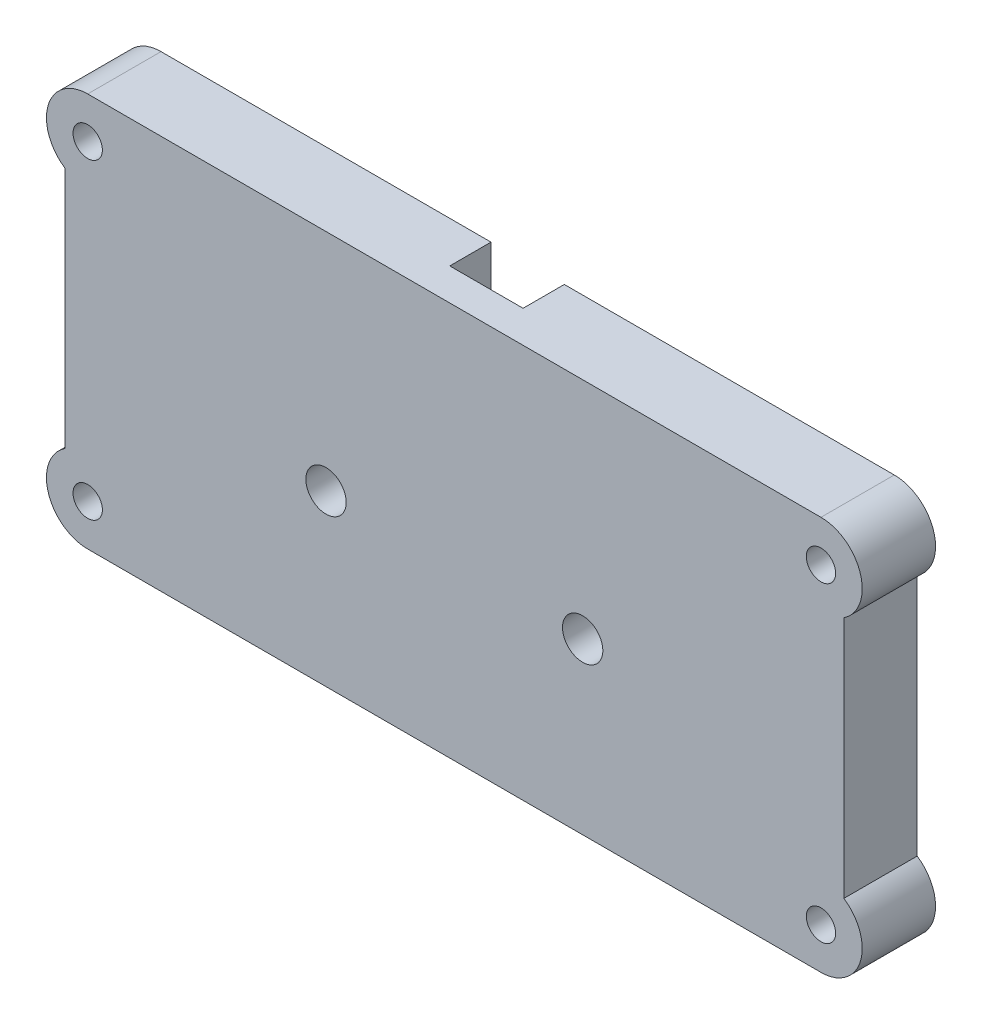
from build123d import *

# Parameters (mm, degrees)
SKETCH1_R           = 1.6
BOSS_EXTRUDE1_DEPTH = 8
CUT_EXTRUDE4_DEPTH  = 1.7
CUT_EXTRUDE5_DEPTH  = 7.4
SKETCH1_9_W         = 8
SKETCH1_9_H         = 13.9
CUT_EXTRUDE6_DEPTH  = 4.5
SKETCH2_R           = 2.2
CUT_EXTRUDE11_DEPTH = 6


with BuildPart() as part:
    # Sketch1 → Boss-Extrude1 (new body)
    with BuildSketch(Plane.XY):
        with BuildLine():
            Line((-42.5, 13.258342613), (-42.5, -13.258342613))
            ThreePointArc((-42.5, -13.258342613), (-44.30624304, -18.30624304), (-40, -21.5))
            Line((-40, -21.5), (40, -21.5))
            ThreePointArc((40, -21.5), (44.30624304, -18.30624304), (42.5, -13.258342613))
            Line((42.5, -13.258342613), (42.5, 13.258342613))
            ThreePointArc((42.5, 13.258342613), (44.30624304, 18.30624304), (40, 21.5))
            Line((40, 21.5), (-40, 21.5))
            ThreePointArc((-40, 21.5), (-44.30624304, 18.30624304), (-42.5, 13.258342613))
        make_face()
        with Locations((-40, -17)):
            Circle(SKETCH1_R, mode=Mode.SUBTRACT)
        with Locations((40, -17)):
            Circle(SKETCH1_R, mode=Mode.SUBTRACT)
        with Locations((-40, 17)):
            Circle(SKETCH1_R, mode=Mode.SUBTRACT)
        with Locations((40, 17)):
            Circle(SKETCH1_R, mode=Mode.SUBTRACT)
    extrude(amount=BOSS_EXTRUDE1_DEPTH)

    # Sketch1<7> → Cut-Extrude4 (cut)
    with BuildSketch(Plane.XY):
        with BuildLine():
            Line((-5.489949494, 9.874011537), (-9.828784258, 14.212846302))
            ThreePointArc((-9.828784258, 14.212846302), (-14.212846302, 14.212846302), (-14.212846302, 9.828784258))
            Line((-14.212846302, 9.828784258), (-9.874011537, 5.489949494))
            ThreePointArc((-9.874011537, 5.489949494), (-7.6, 0), (-9.874011537, -5.489949494))
            Line((-9.874011537, -5.489949494), (-14.212846302, -9.828784258))
            ThreePointArc((-14.212846302, -9.828784258), (-14.212846302, -14.212846302), (-9.828784258, -14.212846302))
            Line((-9.828784258, -14.212846302), (-5.489949494, -9.874011537))
            ThreePointArc((-5.489949494, -9.874011537), (0, -7.6), (5.489949494, -9.874011537))
            Line((5.489949494, -9.874011537), (9.828784258, -14.212846302))
            ThreePointArc((9.828784258, -14.212846302), (14.212846302, -14.212846302), (14.212846302, -9.828784258))
            Line((14.212846302, -9.828784258), (9.874011537, -5.489949494))
            ThreePointArc((9.874011537, -5.489949494), (7.6, 0), (9.874011537, 5.489949494))
            Line((9.874011537, 5.489949494), (14.212846302, 9.828784258))
            ThreePointArc((14.212846302, 9.828784258), (14.212846302, 14.212846302), (9.828784258, 14.212846302))
            Line((9.828784258, 14.212846302), (5.489949494, 9.874011537))
            ThreePointArc((5.489949494, 9.874011537), (0, 7.6), (-5.489949494, 9.874011537))
        make_face()
    extrude(amount=CUT_EXTRUDE4_DEPTH, mode=Mode.SUBTRACT)

    # Sketch1<8> → Cut-Extrude5 (cut)
    with BuildSketch(Plane.XY):
        Polygon((-7.1, -3.85), (7.1, -3.85), (7.1, 3.85), (7.1, 7.6), (-7.1, 7.6), (-7.1, 3.85), align=None)
    extrude(amount=CUT_EXTRUDE5_DEPTH, mode=Mode.SUBTRACT)

    # Sketch1<9> → Cut-Extrude6 (cut)
    with BuildSketch(Plane.XY):
        with Locations((0, 14.55)):
            Rectangle(SKETCH1_9_W, SKETCH1_9_H)
    extrude(amount=CUT_EXTRUDE6_DEPTH, mode=Mode.SUBTRACT)

    # Sketch2 → Cut-Extrude11 (cut)
    with BuildSketch(Plane.XY.offset(8)):
        with Locations((-14, -3)):
            Circle(SKETCH2_R)
        with Locations((14, -3)):
            Circle(SKETCH2_R)
    extrude(amount=-CUT_EXTRUDE11_DEPTH, mode=Mode.SUBTRACT)


solid = part.part
